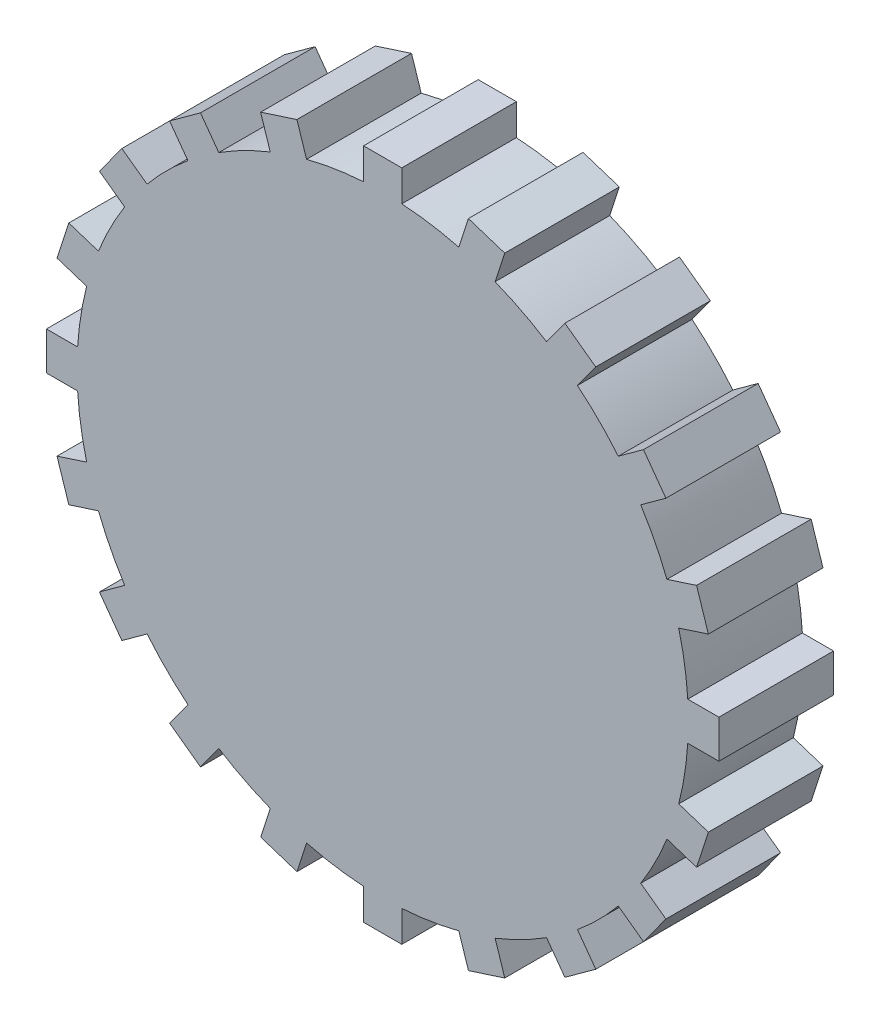
from build123d import *

# Parameters (mm, degrees)
SKETCH_1_R               = 40
EXTRUDE_1_DEPTH          = 15
SKETCH_2_W               = 4.077896861
SKETCH_2_H               = 4.995131446
EXTRUDE_2_DEPTH          = 15
PATTERN_CIRCULAR_1_COUNT = 20


with BuildPart() as part:
    # 草图1 → 凸台-拉伸1 (new body)
    with BuildSketch(Plane.XY):
        Circle(SKETCH_1_R)
    extrude(amount=EXTRUDE_1_DEPTH)

    # 草图2 → 凸台-拉伸2 (add)
    with BuildSketch(Plane.XY):
        with Locations((41.96105157, 0.002434277)):
            Rectangle(SKETCH_2_W, SKETCH_2_H)
    extrude_2 = extrude(amount=EXTRUDE_2_DEPTH)

    # 阵列(圆周)1: 凸台-拉伸2 ×20 about axis
    pattern_circular_1_axis = Axis((0, 0, 15), (0, 0, -1))
    for i in range(1, PATTERN_CIRCULAR_1_COUNT):
        add(extrude_2.rotate(pattern_circular_1_axis, i * 360 / PATTERN_CIRCULAR_1_COUNT))


solid = part.part
